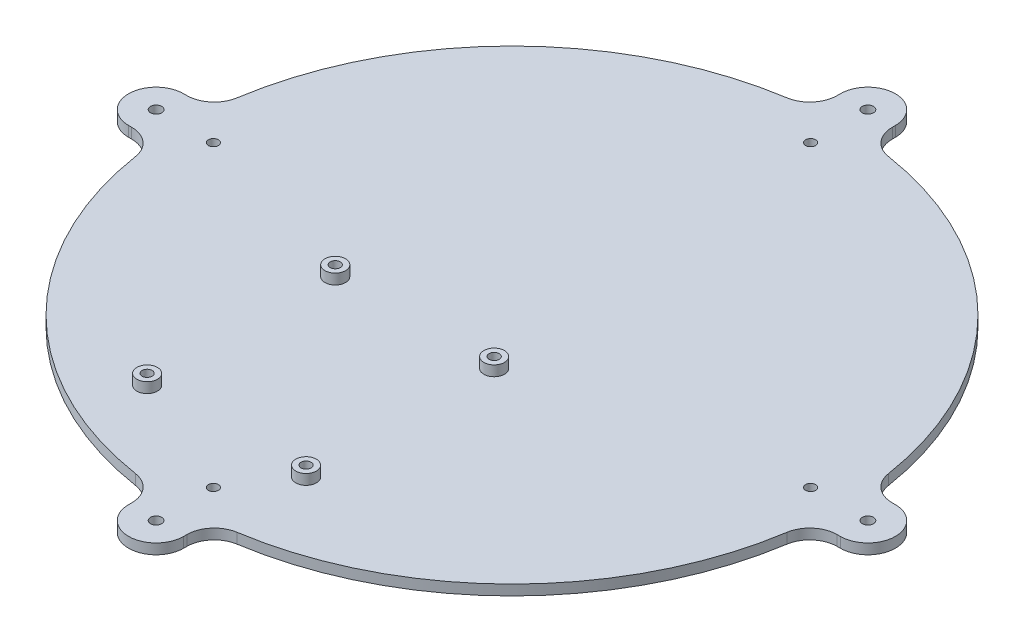
from build123d import *

# Parameters (mm, degrees)
SKETCH1_R                                            = 1.7272
BOSS_EXTRUDE1_DEPTH                                  = 3.175
FILLET2_R                                            = 8.4836
SKETCH2_R                                            = 3.175
BOSS_EXTRUDE2_DEPTH                                  = 3.175
CSK_FOR_M2_5_CROSS_COUNTERSUNK_HEAD_SCRE_D           = 3.1
CSK_FOR_M2_5_CROSS_COUNTERSUNK_HEAD_SCRE_CSINK_D     = 5
CSK_FOR_M2_5_CROSS_COUNTERSUNK_HEAD_SCRE_CSINK_ANGLE = 92
CSK_FOR_M2_5_CROSS_COUNTERSUNK_HEAD_2_D              = 3.1
CSK_FOR_M2_5_CROSS_COUNTERSUNK_HEAD_2_CSINK_D        = 5
CSK_FOR_M2_5_CROSS_COUNTERSUNK_HEAD_2_CSINK_ANGLE    = 92


with BuildPart() as part:
    # Sketch1 → Boss-Extrude1 (new body)
    with BuildSketch(Plane(origin=(0, 0, 0), x_dir=(1, 0, 0), z_dir=(0, 1, 0))):
        with BuildLine():
            Line((-8.4836, 101.245190162), (-8.4836, 109.728790162))
            ThreePointArc((-8.4836, 109.728790162), (0, 118.212390162), (8.4836, 109.728790162))
            Line((8.4836, 109.728790162), (8.4836, 101.245190162))
            ThreePointArc((8.4836, 101.245190162), (71.842048969, 71.842048969), (101.245190162, 8.4836))
            Line((101.245190162, 8.4836), (109.728790162, 8.4836))
            ThreePointArc((109.728790162, 8.4836), (118.212390162, 0), (109.728790162, -8.4836))
            Line((109.728790162, -8.4836), (101.245190162, -8.4836))
            ThreePointArc((101.245190162, -8.4836), (71.842048969, -71.842048969), (8.4836, -101.245190162))
            Line((8.4836, -101.245190162), (8.4836, -109.728790162))
            ThreePointArc((8.4836, -109.728790162), (0, -118.212390162), (-8.4836, -109.728790162))
            Line((-8.4836, -109.728790162), (-8.4836, -101.245190162))
            ThreePointArc((-8.4836, -101.245190162), (-71.842048969, -71.842048969), (-101.245190162, -8.4836))
            Line((-101.245190162, -8.4836), (-109.728790162, -8.4836))
            ThreePointArc((-109.728790162, -8.4836), (-118.212390162, 0), (-109.728790162, 8.4836))
            Line((-109.728790162, 8.4836), (-101.245190162, 8.4836))
            ThreePointArc((-101.245190162, 8.4836), (-71.842048969, 71.842048969), (-8.4836, 101.245190162))
        make_face()
        with Locations(Location((0, 109.728790162, 0), (0, 0, 270))):
            Circle(SKETCH1_R, mode=Mode.SUBTRACT)
        with Locations(Location((109.728790162, 0, 0), (0, 0, 270))):
            Circle(SKETCH1_R, mode=Mode.SUBTRACT)
        with Locations(Location((0, -109.728790162, 0), (0, 0, 270))):
            Circle(SKETCH1_R, mode=Mode.SUBTRACT)
        with Locations(Location((-109.728790163, 0, 0), (0, 0, 270))):
            Circle(SKETCH1_R, mode=Mode.SUBTRACT)
    extrude(amount=BOSS_EXTRUDE1_DEPTH)

    # Fillet2
    fillet2_edges = [part.edges().sort_by_distance(p)[0] for p in [
        (8.4836, 1.5875, -101.245190162),
        (101.245190162, 1.5875, -8.4836),
        (101.245190162, 1.5875, 8.4836),
        (8.4836, 1.5875, 101.245190162),
        (-8.4836, 1.5875, 101.245190162),
        (-101.245190162, 1.5875, 8.4836),
        (-101.245190162, 1.5875, -8.4836),
        (-8.4836, 1.5875, -101.245190162),
    ]]
    fillet(fillet2_edges, radius=FILLET2_R)

    # Sketch2 → Boss-Extrude2 (add)
    with BuildSketch(Plane(origin=(0, 3.175, 0), x_dir=(1, 0, 0), z_dir=(0, 1, 0))):
        with Locations(Location((-37.514063478, -74.985936522, 0), (0, 0, 270))):
            Circle(SKETCH2_R)
        with Locations(Location((-37.514063478, -16.985936522, 0), (0, 0, 270))):
            Circle(SKETCH2_R)
        with Locations(Location((11.485936522, -74.985936522, 0), (0, 0, 90))):
            Circle(SKETCH2_R)
        with Locations(Location((11.485936522, -16.985936522, 0), (0, 0, 90))):
            Circle(SKETCH2_R)
    extrude(amount=BOSS_EXTRUDE2_DEPTH)

    # CSK for M2.5 Cross Countersunk Head Scre (through all)
    with Locations(Plane(origin=(0, 0, 0), x_dir=(-1, 0, 0), z_dir=(0, -1, 0))):
        with Locations((-11.485936522, -16.985936522), (37.514063478, -16.985936522), (37.514063478, -74.985936522), (-11.485936522, -74.985936522)):
            CounterSinkHole(CSK_FOR_M2_5_CROSS_COUNTERSUNK_HEAD_SCRE_D / 2, CSK_FOR_M2_5_CROSS_COUNTERSUNK_HEAD_SCRE_CSINK_D / 2, counter_sink_angle=CSK_FOR_M2_5_CROSS_COUNTERSUNK_HEAD_SCRE_CSINK_ANGLE)

    # CSK for M2.5 Cross Countersunk Head  2 (through all)
    with Locations(Plane(origin=(0, 0, 0), x_dir=(-1, 0, 0), z_dir=(0, -1, 0))):
        with Locations((0, 92.075), (0, -92.075), (92.075, 0), (-92.075, 0)):
            CounterSinkHole(CSK_FOR_M2_5_CROSS_COUNTERSUNK_HEAD_2_D / 2, CSK_FOR_M2_5_CROSS_COUNTERSUNK_HEAD_2_CSINK_D / 2, counter_sink_angle=CSK_FOR_M2_5_CROSS_COUNTERSUNK_HEAD_2_CSINK_ANGLE)


solid = part.part
